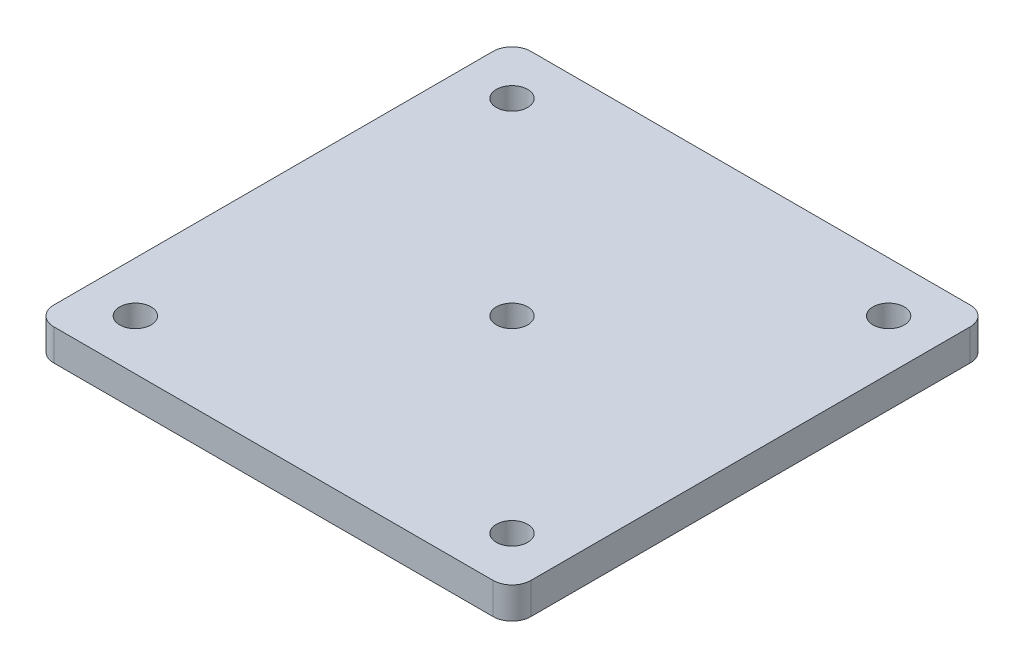
from build123d import *

# Parameters (mm, degrees)
SKETCH1_R           = 2.5
BOSS_EXTRUDE1_DEPTH = 5


with BuildPart() as part:
    # Sketch1 → Boss-Extrude1 (new body)
    with BuildSketch(Plane(origin=(0, 0, 0), x_dir=(1, 0, 0), z_dir=(0, 1, 0))):
        with BuildLine():
            Line((-35, -38), (35, -38))
            ThreePointArc((35, -38), (37.121320344, -37.121320344), (38, -35))
            Line((38, -35), (38, 35))
            ThreePointArc((38, 35), (37.121320344, 37.121320344), (35, 38))
            Line((35, 38), (-35, 38))
            ThreePointArc((-35, 38), (-37.121320344, 37.121320344), (-38, 35))
            Line((-38, 35), (-38, -35))
            ThreePointArc((-38, -35), (-37.121320344, -37.121320344), (-35, -38))
        make_face()
        with Locations(Location((0, 0, 0), (0, 0, 270))):
            Circle(SKETCH1_R, mode=Mode.SUBTRACT)
        with Locations(Location((-30, -30, 0), (0, 0, 270))):
            Circle(SKETCH1_R, mode=Mode.SUBTRACT)
        with Locations(Location((-30, 30, 0), (0, 0, 270))):
            Circle(SKETCH1_R, mode=Mode.SUBTRACT)
        with Locations(Location((30, 30, 0), (0, 0, 270))):
            Circle(SKETCH1_R, mode=Mode.SUBTRACT)
        with Locations(Location((30, -30, 0), (0, 0, 270))):
            Circle(SKETCH1_R, mode=Mode.SUBTRACT)
    extrude(amount=BOSS_EXTRUDE1_DEPTH)


solid = part.part
